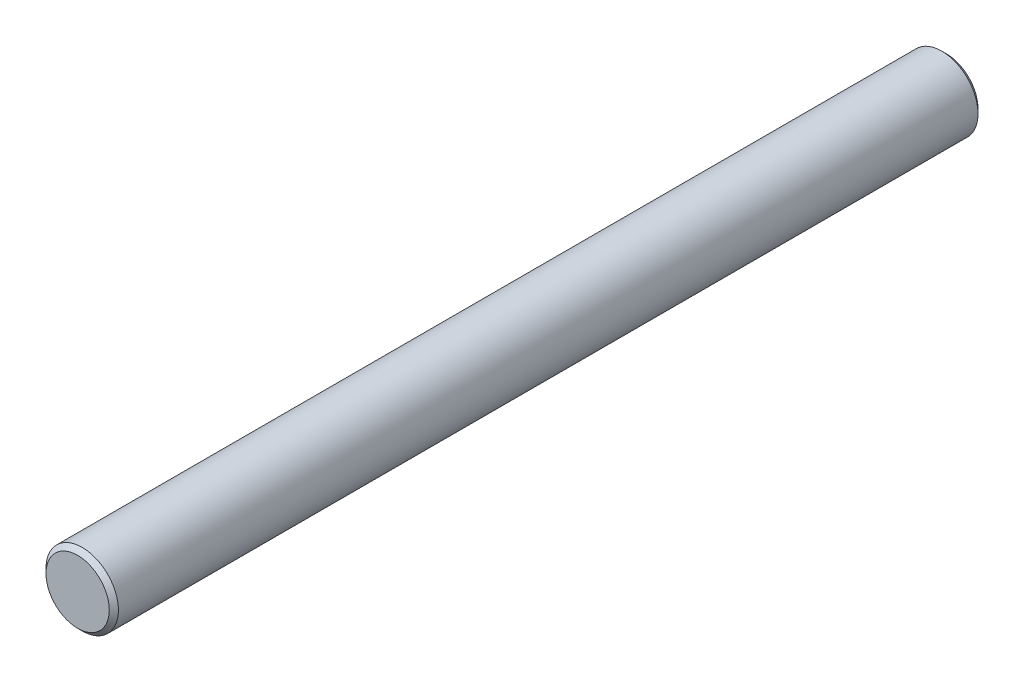
from build123d import *

# Parameters (mm, degrees)
SKETCH1_R           = 3.175
BOSS_EXTRUDE1_DEPTH = 76.2
CHAMFER1_SIZE       = 0.4


with BuildPart() as part:
    # Sketch1 → Boss-Extrude1 (new body)
    with BuildSketch(Plane.XY):
        with Locations(Location((0, 0, 0), (0, 0, 180))):
            Circle(SKETCH1_R)
    extrude(amount=BOSS_EXTRUDE1_DEPTH)

    # Chamfer1
    chamfer1_edges = [part.edges().sort_by_distance(p)[0] for p in [
        (3.175, 0, 0),
        (3.175, 0, 76.2),
    ]]
    chamfer(chamfer1_edges, length=CHAMFER1_SIZE)


solid = part.part
